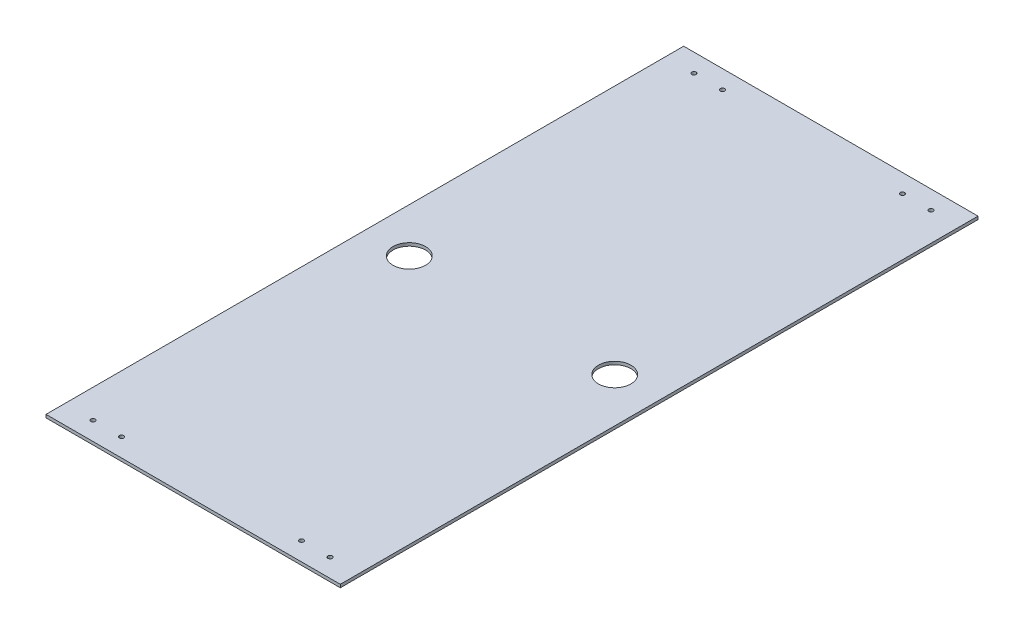
from build123d import *

# Parameters (mm, degrees)
SKETCH1_W           = 304.8
SKETCH1_H           = 660.4
SKETCH1_R           = 16.8275
SKETCH1_R_2         = 2.2479
BOSS_EXTRUDE1_DEPTH = 3.175


with BuildPart() as part:
    # Sketch1 → Boss-Extrude1 (new body)
    with BuildSketch(Plane(origin=(0, 0, 0), x_dir=(1, 0, 0), z_dir=(0, 1, 0))):
        with Locations((152.4, 330.2)):
            Rectangle(SKETCH1_W, SKETCH1_H)
        with Locations(Location((46.0248, 330.2, 0), (0, 0, 270))):
            Circle(SKETCH1_R, mode=Mode.SUBTRACT)
        with Locations(Location((258.7752, 330.2, 0), (0, 0, 270))):
            Circle(SKETCH1_R, mode=Mode.SUBTRACT)
        with Locations(Location((29.633333333, 19.05, 0), (0, 0, 270))):
            Circle(SKETCH1_R_2, mode=Mode.SUBTRACT)
        with Locations(Location((59.266666667, 19.05, 0), (0, 0, 270))):
            Circle(SKETCH1_R_2, mode=Mode.SUBTRACT)
        with Locations(Location((245.533333333, 19.05, 0), (0, 0, 270))):
            Circle(SKETCH1_R_2, mode=Mode.SUBTRACT)
        with Locations(Location((275.166666667, 19.05, 0), (0, 0, 270))):
            Circle(SKETCH1_R_2, mode=Mode.SUBTRACT)
        with Locations(Location((275.166666667, 641.35, 0), (0, 0, 270))):
            Circle(SKETCH1_R_2, mode=Mode.SUBTRACT)
        with Locations(Location((245.533333333, 641.35, 0), (0, 0, 270))):
            Circle(SKETCH1_R_2, mode=Mode.SUBTRACT)
        with Locations(Location((59.266666667, 641.35, 0), (0, 0, 270))):
            Circle(SKETCH1_R_2, mode=Mode.SUBTRACT)
        with Locations(Location((29.633333333, 641.35, 0), (0, 0, 270))):
            Circle(SKETCH1_R_2, mode=Mode.SUBTRACT)
    extrude(amount=BOSS_EXTRUDE1_DEPTH)


solid = part.part
